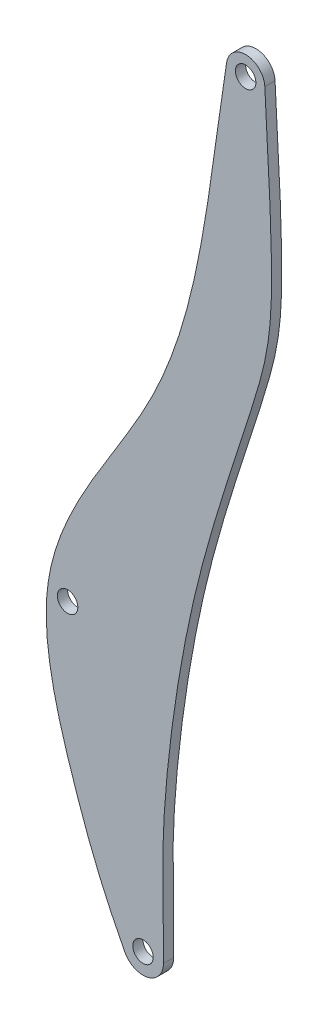
from build123d import *

# Parameters (mm, degrees)
SKETCH_1_R      = 10
EXTRUDE_1_DEPTH = 10


with BuildPart() as part:
    # 草图1 → 凸台-拉伸1 (new body)
    with BuildSketch(Plane.XY):
        with BuildLine():
            ThreePointArc((102.311199765, 375.112029052), (84.51881015, 392.813872233), (65.036461943, 376.991025191))
            add(Edge.make_bspline(
                [(65.036461943, 376.991025191), (45.889114215, 252.94224697), (35.523806995, 78.694440088), (-140.807905589, -126.022717356), (-84.82622195, -308.616556427), (-57.331193012, -381.18062786), (-34.136574311, -425.390150911)],
                knots=[0, 0, 0, 0, 0.3944471, 0.667710935, 0.855398119, 1, 1, 1, 1], degree=3))
            ThreePointArc((-34.136574311, -425.390150911), (-11.630086846, -435.088456797), (3.37189665, -415.709612502))
            add(Edge.make_bspline(
                [(102.311199765, 375.112029052), (112.225704632, 196.555058064), (112.566880399, 154.384362349), (23.686233986, -90.793091468), (0.034750928, -297.28578118), (3.331067876, -354.836460231), (3.37189665, -415.709612502)],
                knots=[0, 0, 0, 0, 0.332735052, 0.581141854, 0.871633558, 1, 1, 1, 1], degree=3))
        make_face()
        with Locations((83.57402568, 374.071633918)):
            Circle(SKETCH_1_R, mode=Mode.SUBTRACT)
        with Locations((-90.260469952, -156.580915428)):
            Circle(SKETCH_1_R, mode=Mode.SUBTRACT)
        with Locations((-16.628098851, -415.723026877)):
            Circle(SKETCH_1_R, mode=Mode.SUBTRACT)
    extrude(amount=EXTRUDE_1_DEPTH)


solid = part.part
